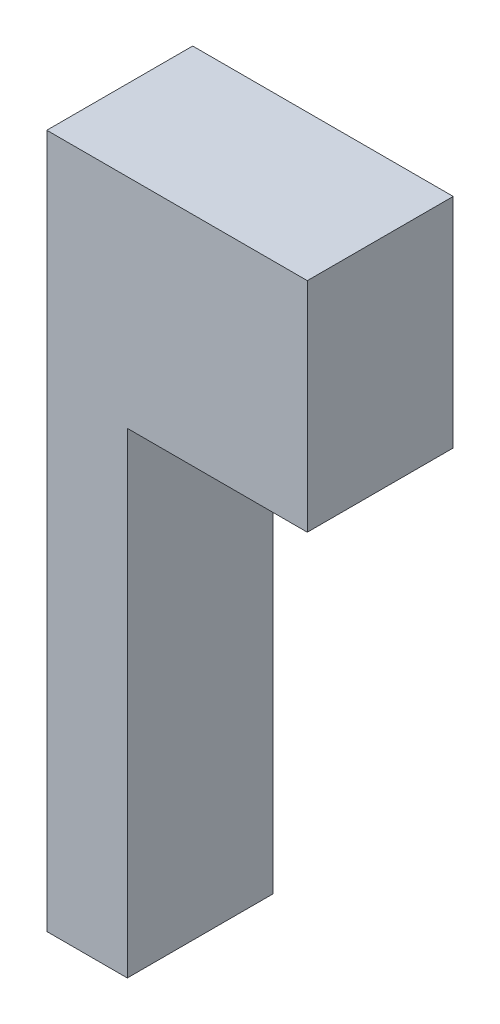
from build123d import *

# Parameters (mm, degrees)
SKETCH1_W           = 3.4
SKETCH1_H           = 20.1
SKETCH1_W_2         = 11
SKETCH1_H_2         = 9.2
BOSS_EXTRUDE1_DEPTH = 6.16


with BuildPart() as part:
    # Sketch1 → Boss-Extrude1 (new body)
    with BuildSketch(Plane.XY):
        with Locations((1.7, 10.05)):
            Rectangle(SKETCH1_W, SKETCH1_H)
        with Locations((5.5, 24.7)):
            Rectangle(SKETCH1_W_2, SKETCH1_H_2)
    extrude(amount=BOSS_EXTRUDE1_DEPTH)


solid = part.part
